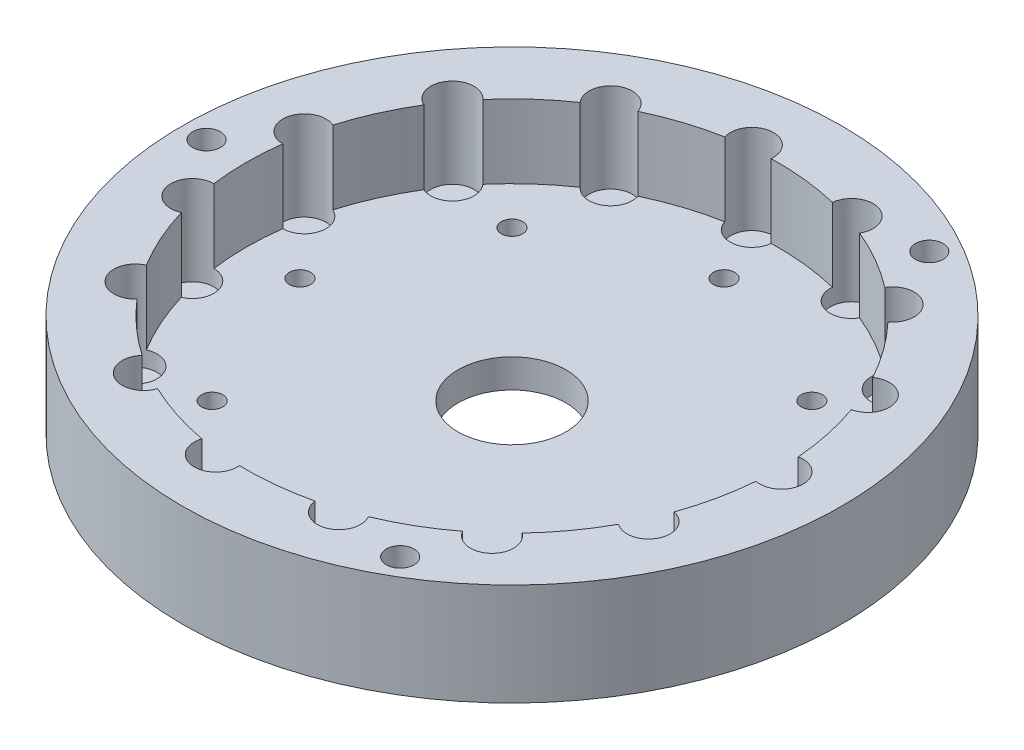
from build123d import *

# Parameters (mm, degrees)
SKETCH1_R           = 45.85
SKETCH1_R_2         = 1.5635
SKETCH1_R_3         = 7.5
BOSS_EXTRUDE1_DEPTH = 4
SKETCH1_6_R         = 3
SKETCH1_6_R_2       = 1.48
CUT_EXTRUDE1_DEPTH  = 2.22
BOSS_EXTRUDE2_START = 10.22
SKETCH1_7_R         = 45.85
SKETCH1_7_R_2       = 1.5635
BOSS_EXTRUDE2_DEPTH = 10.22
SKETCH2_R           = 1.925
CUT_EXTRUDE2_DEPTH  = 4


with BuildPart() as part:
    # Sketch1 → Boss-Extrude1 (new body)
    with BuildSketch(Plane(origin=(0, 0, 0), x_dir=(1, 0, 0), z_dir=(0, 1, 0))):
        Circle(SKETCH1_R)
        with Locations((-42.5, 0)):
            Circle(SKETCH1_R_2, mode=Mode.SUBTRACT)
        with Locations((21.25, -36.806079661)):
            Circle(SKETCH1_R_2, mode=Mode.SUBTRACT)
        with Locations((21.25, 36.806079661)):
            Circle(SKETCH1_R_2, mode=Mode.SUBTRACT)
        Circle(SKETCH1_R_3, mode=Mode.SUBTRACT)
    extrude(amount=-BOSS_EXTRUDE1_DEPTH)

    # Sketch1<6> → Cut-Extrude1 (cut)
    with BuildSketch(Plane(origin=(0, 0, 0), x_dir=(1, 0, 0), z_dir=(0, 1, 0))):
        with Locations((37.5, 0)):
            Circle(SKETCH1_6_R)
        with Locations((34.257954662, 15.252624115)):
            Circle(SKETCH1_6_R)
        with Locations((34.257954662, -15.252624115)):
            Circle(SKETCH1_6_R)
        with Locations((25.092397738, 27.867930955)):
            Circle(SKETCH1_6_R)
        with Locations((25.092397738, -27.867930955)):
            Circle(SKETCH1_6_R)
        with Locations((11.588137289, 35.664619361)):
            Circle(SKETCH1_6_R)
        with Locations((11.588137289, -35.664619361)):
            Circle(SKETCH1_6_R)
        with Locations((-3.919817373, 37.294571076)):
            Circle(SKETCH1_6_R)
        with Locations((-3.919817373, -37.294571076)):
            Circle(SKETCH1_6_R)
        with Locations((-18.75, 32.475952642)):
            Circle(SKETCH1_6_R)
        with Locations((-18.75, -32.475952642)):
            Circle(SKETCH1_6_R)
        with Locations((-30.338137289, 22.041946961)):
            Circle(SKETCH1_6_R)
        with Locations((-30.338137289, -22.041946961)):
            Circle(SKETCH1_6_R)
        with Locations((-36.680535028, 7.796688406)):
            Circle(SKETCH1_6_R)
        with Locations((-36.680535028, -7.796688406)):
            Circle(SKETCH1_6_R)
        with Locations((29.5, 0)):
            Circle(SKETCH1_6_R_2)
        with Locations((20.859650045, -20.859650045)):
            Circle(SKETCH1_6_R_2)
        with Locations((0, -29.5)):
            Circle(SKETCH1_6_R_2)
        with Locations((-20.859650045, -20.859650045)):
            Circle(SKETCH1_6_R_2)
        with Locations((-29.5, 0)):
            Circle(SKETCH1_6_R_2)
        with Locations((-20.859650045, 20.859650045)):
            Circle(SKETCH1_6_R_2)
        with Locations((0, 29.5)):
            Circle(SKETCH1_6_R_2)
        with Locations((20.859650045, 20.859650045)):
            Circle(SKETCH1_6_R_2)
    extrude(amount=-CUT_EXTRUDE1_DEPTH, mode=Mode.SUBTRACT)

    # Sketch1<7> → Boss-Extrude2 (add)
    with BuildSketch(Plane(origin=(0, 0, 0), x_dir=(1, 0, 0), z_dir=(0, 1, 0)).offset(BOSS_EXTRUDE2_START)):
        Circle(SKETCH1_7_R)
        with Locations((-42.5, 0)):
            Circle(SKETCH1_7_R_2, mode=Mode.SUBTRACT)
        with Locations((21.25, -36.806079661)):
            Circle(SKETCH1_7_R_2, mode=Mode.SUBTRACT)
        with BuildLine():
            ThreePointArc((36.883333333, 2.935936345), (39.39076704, 2.32916294), (40.5, 0))
            ThreePointArc((40.5, 0), (39.39076704, -2.32916294), (36.883333333, -2.935936345))
            ThreePointArc((36.883333333, -2.935936345), (36.191461227, -7.69273256), (34.888754523, -12.319691873))
            ThreePointArc((34.888754523, -12.319691873), (36.59166411, -13.367471546), (37.257954662, -15.252624115))
            ThreePointArc((37.257954662, -15.252624115), (35.6231437, -17.924001829), (32.500448736, -17.683914497))
            ThreePointArc((32.500448736, -17.683914497), (29.933628792, -21.748054335), (26.861593101, -25.445133446))
            ThreePointArc((26.861593101, -25.445133446), (27.767055295, -26.50917897), (28.092397738, -27.867930955))
            ThreePointArc((28.092397738, -27.867930955), (25.872343464, -30.764771418), (22.497941295, -29.37418318))
            ThreePointArc((22.497941295, -29.37418318), (18.5, -32.04293994), (14.189818202, -34.170880284))
            ThreePointArc((14.189818202, -34.170880284), (14.486847583, -34.891651942), (14.588137289, -35.664619361))
            ThreePointArc((14.588137289, -35.664619361), (11.748752331, -38.660316744), (8.605335417, -35.985388734))
            ThreePointArc((8.605335417, -35.985388734), (3.867553141, -36.797310129), (-0.935505175, -36.988171489))
            ThreePointArc((-0.935505175, -36.988171489), (-0.92374189, -37.141170608), (-0.919817373, -37.294571076))
            ThreePointArc((-0.919817373, -37.294571076), (-4.385552663, -40.258199029), (-6.775211132, -36.37439366))
            ThreePointArc((-6.775211132, -36.37439366), (-11.433628792, -35.189091103), (-15.899071208, -33.409871815))
            ThreePointArc((-15.899071208, -33.409871815), (-20.25, -35.074028853), (-20.984262125, -30.47393547))
            ThreePointArc((-20.984262125, -30.47393547), (-24.757832435, -27.496358543), (-28.113543391, -24.054701786))
            ThreePointArc((-28.113543391, -24.054701786), (-32.765188272, -23.805302718), (-31.564943561, -19.304256991))
            ThreePointArc((-31.564943561, -19.304256991), (-33.801181933, -15.049255794), (-35.466928517, -10.540255288))
            ThreePointArc((-35.466928517, -10.540255288), (-39.61497783, -8.420423478), (-36.687759497, -4.796697105))
            ThreePointArc((-36.687759497, -4.796697105), (-37, 0), (-36.687759497, 4.796697105))
            ThreePointArc((-36.687759497, 4.796697105), (-39.61497783, 8.420423478), (-35.466928517, 10.540255288))
            ThreePointArc((-35.466928517, 10.540255288), (-33.801181933, 15.049255794), (-31.564943561, 19.304256991))
            ThreePointArc((-31.564943561, 19.304256991), (-32.765188272, 23.805302718), (-28.113543391, 24.054701786))
            ThreePointArc((-28.113543391, 24.054701786), (-24.757832435, 27.496358543), (-20.984262125, 30.47393547))
            ThreePointArc((-20.984262125, 30.47393547), (-20.25, 35.074028853), (-15.899071208, 33.409871815))
            ThreePointArc((-15.899071208, 33.409871815), (-11.433628792, 35.189091103), (-6.775211132, 36.37439366))
            ThreePointArc((-6.775211132, 36.37439366), (-4.385552663, 40.258199029), (-0.919817373, 37.294571076))
            ThreePointArc((-0.919817373, 37.294571076), (-0.92374189, 37.141170608), (-0.935505175, 36.988171489))
            ThreePointArc((-0.935505175, 36.988171489), (3.867553141, 36.797310129), (8.605335417, 35.985388734))
            ThreePointArc((8.605335417, 35.985388734), (11.748752331, 38.660316744), (14.588137289, 35.664619361))
            ThreePointArc((14.588137289, 35.664619361), (14.486847583, 34.891651942), (14.189818202, 34.170880284))
            ThreePointArc((14.189818202, 34.170880284), (18.5, 32.04293994), (22.497941295, 29.37418318))
            ThreePointArc((22.497941295, 29.37418318), (25.872343464, 30.764771418), (28.092397738, 27.867930955))
            ThreePointArc((28.092397738, 27.867930955), (27.767055295, 26.50917897), (26.861593101, 25.445133446))
            ThreePointArc((26.861593101, 25.445133446), (29.933628792, 21.748054335), (32.500448736, 17.683914497))
            ThreePointArc((32.500448736, 17.683914497), (35.6231437, 17.924001829), (37.257954662, 15.252624115))
            ThreePointArc((37.257954662, 15.252624115), (36.59166411, 13.367471546), (34.888754523, 12.319691873))
            ThreePointArc((34.888754523, 12.319691873), (36.191461227, 7.69273256), (36.883333333, 2.935936345))
        make_face(mode=Mode.SUBTRACT)
        with Locations((21.25, 36.806079661)):
            Circle(SKETCH1_7_R_2, mode=Mode.SUBTRACT)
    extrude(amount=-BOSS_EXTRUDE2_DEPTH)

    # Sketch2 → Cut-Extrude2 (cut)
    with BuildSketch(Plane(origin=(0, 10.22, 0), x_dir=(1, 0, 0), z_dir=(0, 1, 0))):
        with Locations((-42.5, 0)):
            Circle(SKETCH2_R)
        with Locations((21.25, 36.806079661)):
            Circle(SKETCH2_R)
        with Locations((21.25, -36.806079661)):
            Circle(SKETCH2_R)
    extrude(amount=-CUT_EXTRUDE2_DEPTH, mode=Mode.SUBTRACT)


solid = part.part
